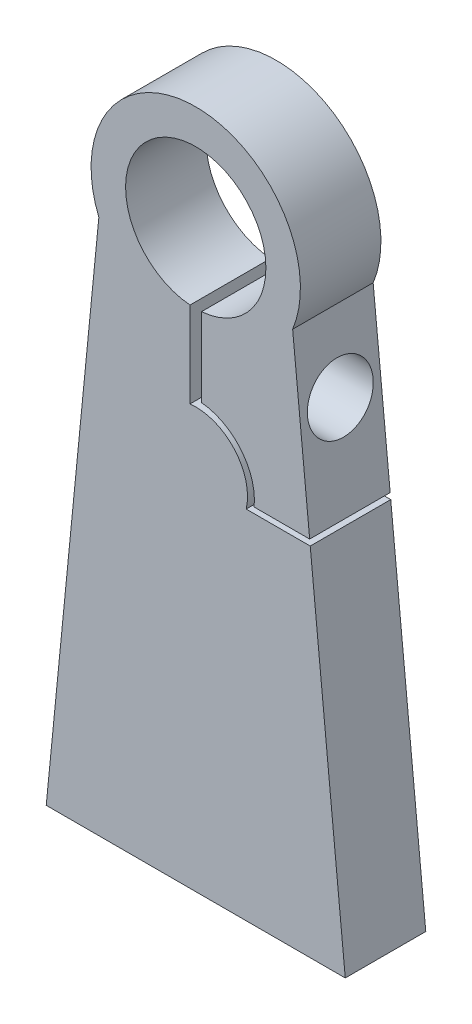
from build123d import *

# Parameters (mm, degrees)
SKETCH1_R                      = 6.1
THICKNESS_DEPTH                = 3.5
BOTNUTCUT_START                = -2
SKETCH2_R                      = 2.85
BOTNUTCUT_DEPTH                = 2.6
SKETCH3_R                      = 1.55
BOTSCREWCUT_DEPTH              = 2
CUT_EXTRUDE1_START             = -7
CUT_EXTRUDE1_DEPTH             = 7
RAILNUTCUT_START               = -2
RAILNUTCUT_DEPTH               = 2.6
SKETCH7_R                      = 1.55
RAILSCREWCUT_DEPTH             = 2.6
RAILSCREWCUT_DIRECTION_2_REACH = 53.909
RAILNUTHEADCUT_REACH           = 56.409
RAILNUTHEADCUT_START           = -2.5
SKETCH8_R                      = 2.85
SKETCH9_W                      = 7
SKETCH9_H                      = 0.5
MOVEMENTCUT_DEPTH              = 7
SKETCH10_R                     = 4.5
BOSS_EXTRUDE1_DEPTH            = 3.5


with BuildPart() as part:
    # Sketch1 → Thickness (new, symmetric)
    with BuildSketch(Plane.XY):
        with BuildLine():
            Line((-13, -50), (13, -50))
            Line((13, -50), (8.424323952, -3.441041405))
            ThreePointArc((8.424323952, -3.441041405), (0, 9.1), (-8.424323952, -3.441041405))
            Line((-8.424323952, -3.441041405), (-13, -50))
        make_face()
        Circle(SKETCH1_R, mode=Mode.SUBTRACT)
    extrude(amount=THICKNESS_DEPTH, both=True)

    # Sketch2 → BotNutCut (cut)
    with BuildSketch(Plane.XZ.offset(50).offset(BOTNUTCUT_START)):
        with Locations((-7.5, 0)):
            Circle(SKETCH2_R)
        with BuildLine():
            Line((-10.790896534, 2.85), (-10.790896534, 0))
            Line((-10.790896534, 0), (-9.968172361, -1.42500007))
            ThreePointArc((-9.968172361, -1.42500007), (-9.96817242, 1.424999968), (-7.499999995, 2.85))
            Line((-7.499999995, 2.85), (-10.790896534, 2.85))
        make_face()
        with BuildLine():
            Line((-4.209103466, 2.85), (-7.499999995, 2.85))
            ThreePointArc((-7.499999995, 2.85), (-5.484745672, 2.015254324), (-4.65, 0))
            ThreePointArc((-4.65, 0), (-4.747111384, -0.737634237), (-5.031827556, -1.424999925))
            Line((-5.031827556, -1.424999925), (-4.209103466, 0))
            Line((-4.209103466, 0), (-4.209103466, 2.85))
        make_face()
        with BuildLine():
            ThreePointArc((-5.031827556, -1.424999925), (-6.074999963, -2.468172379), (-7.5, -2.85))
            Line((-7.5, -2.85), (-5.854551733, -2.85))
            Line((-5.854551733, -2.85), (-5.031827556, -1.424999925))
        make_face()
        with BuildLine():
            ThreePointArc((-7.5, -2.85), (-8.924999965, -2.468172421), (-9.968172361, -1.42500007))
            Line((-9.968172361, -1.42500007), (-9.145448267, -2.85))
            Line((-9.145448267, -2.85), (-7.5, -2.85))
        make_face()
        with BuildLine():
            ThreePointArc((7.5, -2.85), (6.074999995, -2.468172398), (5.031827593, -1.42499999))
            Line((5.031827593, -1.42499999), (5.854551733, -2.85))
            Line((5.854551733, -2.85), (7.5, -2.85))
        make_face()
        with BuildLine():
            ThreePointArc((9.968172375, -1.425000045), (8.924999978, -2.468172414), (7.5, -2.85))
            Line((7.5, -2.85), (9.145448267, -2.85))
            Line((9.145448267, -2.85), (9.968172375, -1.425000045))
        make_face()
        with BuildLine():
            Line((10.790896534, 2.85), (7.5, 2.85))
            ThreePointArc((7.5, 2.85), (9.515254326, 2.015254326), (10.35, 0))
            ThreePointArc((10.35, 0), (10.252888598, -0.737634304), (9.968172375, -1.425000045))
            Line((9.968172375, -1.425000045), (10.790896534, 0))
            Line((10.790896534, 0), (10.790896534, 2.85))
        make_face()
        with BuildLine():
            Line((4.209103466, 2.85), (4.209103466, 0))
            Line((4.209103466, 0), (5.031827593, -1.42499999))
            ThreePointArc((5.031827593, -1.42499999), (5.031827602, 1.425000005), (7.5, 2.85))
            Line((7.5, 2.85), (4.209103466, 2.85))
        make_face()
        with Locations((7.5, 0)):
            Circle(SKETCH2_R)
    extrude(amount=-BOTNUTCUT_DEPTH, mode=Mode.SUBTRACT)

    # Sketch3 → BotScrewCut (cut)
    with BuildSketch(Plane.XZ.offset(50)):
        with Locations(Location((-7.5, 0, 0), (0, 0, 270))):
            Circle(SKETCH3_R)
        with Locations(Location((7.5, 0, 0), (0, 0, 270))):
            Circle(SKETCH3_R)
    extrude(amount=-BOTSCREWCUT_DEPTH, mode=Mode.SUBTRACT)

    # Sketch5 → Cut-Extrude1 (cut)
    with BuildSketch(Plane.XY.offset(3.5).offset(CUT_EXTRUDE1_START)):
        with BuildLine():
            ThreePointArc((0.5, -6.079473661), (0, -6.1), (-0.5, -6.079473661))
            Line((-0.5, -6.079473661), (-0.5, -12.924568984))
            ThreePointArc((-0.5, -12.924568984), (0, -23.1), (0.5, -12.924568984))
            Line((0.5, -12.924568984), (0.5, -6.079473661))
        make_face()
    extrude(amount=CUT_EXTRUDE1_DEPTH, mode=Mode.SUBTRACT)

    # Sketch6 → RailNutCut (cut)
    with BuildSketch(Plane(origin=(-0.5, 0, 0), x_dir=(0, 0, -1), z_dir=(1, 0, 0)).offset(RAILNUTCUT_START)):
        Polygon((0, -13.290896534), (2.85, -11.645448267), (2.85, -8.354551733), (0, -6.709103466), (-2.85, -6.709103466), (-2.85, -13.290896534), align=None)
    extrude(amount=-RAILNUTCUT_DEPTH, mode=Mode.SUBTRACT)

    # Sketch7 → RailScrewCut (cut)
    with BuildSketch(Plane(origin=(-0.5, 0, 0), x_dir=(0, 0, -1), z_dir=(1, 0, 0))):
        with Locations(Location((0, -10, 0), (0, 0, 270))):
            Circle(SKETCH7_R)
    extrude(amount=-RAILSCREWCUT_DEPTH, mode=Mode.SUBTRACT)

    # RailScrewCut direction 2: up to this plane
    railscrewcut_direction_2_end = Plane(origin=(13, -50, 3.5), z_dir=(-0.9952055153223801, -0.09780583966162733, 0))
    # Sketch7 → RailScrewCut direction 2 (cut, up to the surface)
    with BuildSketch(Plane(origin=(-0.5, 0, 0), x_dir=(0, 0, -1), z_dir=(1, 0, 0)), mode=Mode.PRIVATE) as railscrewcut_direction_2_sk1:
        with Locations(Location((0, -10, 0), (0, 0, 270))):
            Circle(SKETCH7_R)
    railscrewcut_direction_2_tool1 = split(extrude(railscrewcut_direction_2_sk1.sketch, amount=RAILSCREWCUT_DIRECTION_2_REACH, mode=Mode.PRIVATE), bisect_by=railscrewcut_direction_2_end, keep=Keep.BOTH, mode=Mode.PRIVATE)
    add(railscrewcut_direction_2_tool1.solids().sort_by_distance((-0.5, -10, 0))[0], mode=Mode.SUBTRACT)

    # RailNutHeadCut: up to this plane
    railnutheadcut_end = Plane(origin=(13, -50, 3.5), z_dir=(-0.9952055153223801, -0.09780583966162733, 0))
    # Sketch8 → RailNutHeadCut (cut, up to the surface)
    with BuildSketch(Plane.ZY.offset(-0.5).offset(RAILNUTHEADCUT_START), mode=Mode.PRIVATE) as railnutheadcut_sk1:
        with Locations(Location((0, -10, 0), (0, 0, 270))):
            Circle(SKETCH8_R)
    railnutheadcut_tool1 = split(extrude(railnutheadcut_sk1.sketch, amount=-RAILNUTHEADCUT_REACH, mode=Mode.PRIVATE), bisect_by=railnutheadcut_end, keep=Keep.BOTH, mode=Mode.PRIVATE)
    add(railnutheadcut_tool1.solids().sort_by_distance((3, -10, 0))[0], mode=Mode.SUBTRACT)

    # Sketch9 → MovementCut (cut)
    with BuildSketch(Plane.XY.offset(3.5)):
        with Locations((7.5, -18.75)):
            Rectangle(SKETCH9_W, SKETCH9_H)
    extrude(amount=-MOVEMENTCUT_DEPTH, mode=Mode.SUBTRACT)

    # Sketch10 → Boss-Extrude1 (add, symmetric)
    with BuildSketch(Plane.XY):
        with BuildLine():
            Line((-0.5, -13.527864045), (-0.5, -12.924568984))
            ThreePointArc((-0.5, -12.924568984), (-3.780537731, -21.42308844), (5.0009999, -19))
            Line((5.0009999, -19), (4.387482194, -19))
            ThreePointArc((4.387482194, -19), (-3.356217727, -20.997632828), (-0.5, -13.527864045))
        make_face()
        with Locations((0, -18)):
            Circle(SKETCH10_R)
    extrude(amount=BOSS_EXTRUDE1_DEPTH, both=True)


solid = part.part
